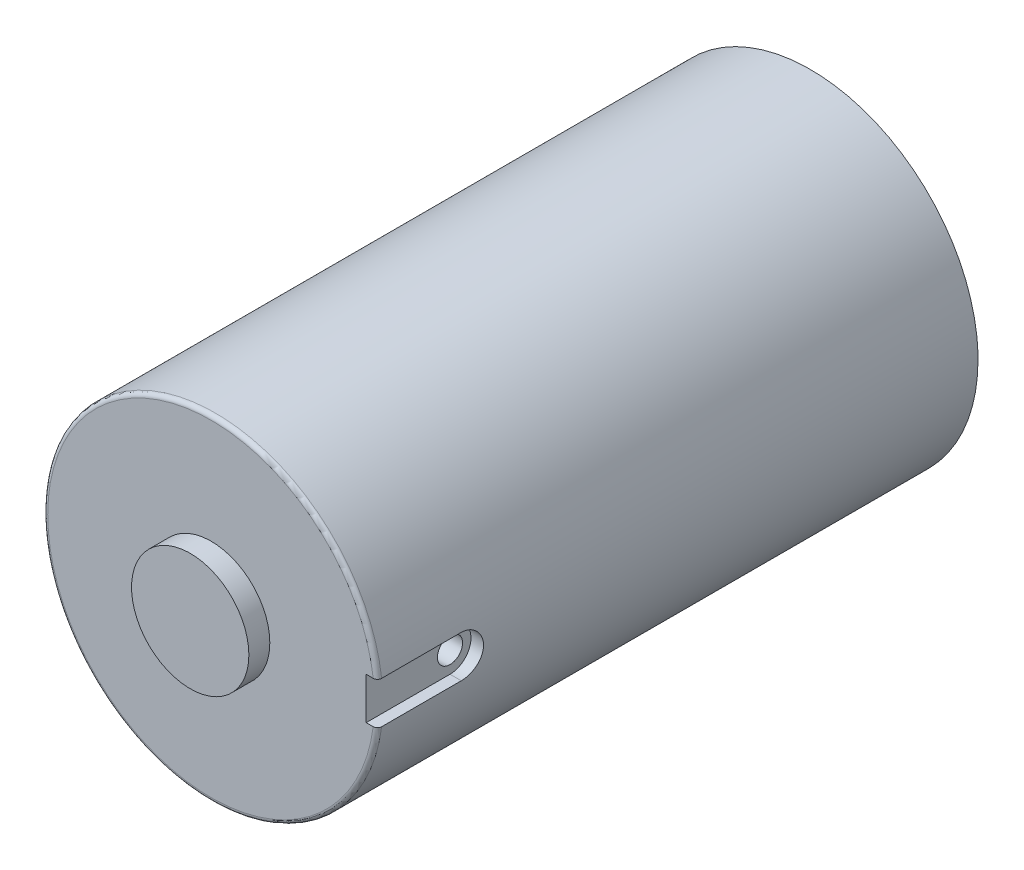
from build123d import *

# Parameters (mm, degrees)
SKETCH_1_R          = 40
EXTRUDE_1_DEPTH     = 113
SKETCH_2_R          = 40
EXTRUDE_2_DEPTH     = 30
SKETCH_3_R          = 14
EXTRUDE_3_DEPTH     = 5
CUT_EXTRUDE_1_DEPTH = 34
SKETCH_6_R          = 3
CUT_EXTRUDE_2_DEPTH = 10
FILLET_1_R          = 1


with BuildPart() as part:
    # 草图1 → 凸台-拉伸1 (new body)
    with BuildSketch(Plane.XY):
        Circle(SKETCH_1_R)
    extrude(amount=EXTRUDE_1_DEPTH)

    # 草图2 → 凸台-拉伸2 (add)
    with BuildSketch(Plane.XY.offset(113)):
        Circle(SKETCH_2_R)
    extrude(amount=EXTRUDE_2_DEPTH)

    # 草图3 → 凸台-拉伸3 (add)
    with BuildSketch(Plane.XY.offset(143)):
        Circle(SKETCH_3_R)
    extrude(amount=EXTRUDE_3_DEPTH)

    # 草图5 → 切除-拉伸1 (cut)
    with BuildSketch(Plane(origin=(37, 0, 0), x_dir=(0, 0, -1), z_dir=(1, 0, 0))):
        with BuildLine():
            Line((-143, 0), (-143, -5))
            Line((-143, -5), (-123, -5))
            ThreePointArc((-123, -5), (-118, 0), (-123, 5))
            Line((-123, 5), (-143, 5))
            Line((-143, 5), (-143, 0))
        make_face()
    extrude(amount=CUT_EXTRUDE_1_DEPTH, mode=Mode.SUBTRACT)

    # 草图6 → 切除-拉伸2 (cut)
    with BuildSketch(Plane(origin=(37, 0, 0), x_dir=(0, 0, -1), z_dir=(1, 0, 0))):
        with Locations((-123, 0)):
            Circle(SKETCH_6_R)
    extrude(amount=-CUT_EXTRUDE_2_DEPTH, mode=Mode.SUBTRACT)

    # 圆角1
    fillet_1_edges = [part.edges().sort_by_distance(p)[0] for p in [
        (-40, 0, 143),
    ]]
    fillet(fillet_1_edges, radius=FILLET_1_R)


solid = part.part
